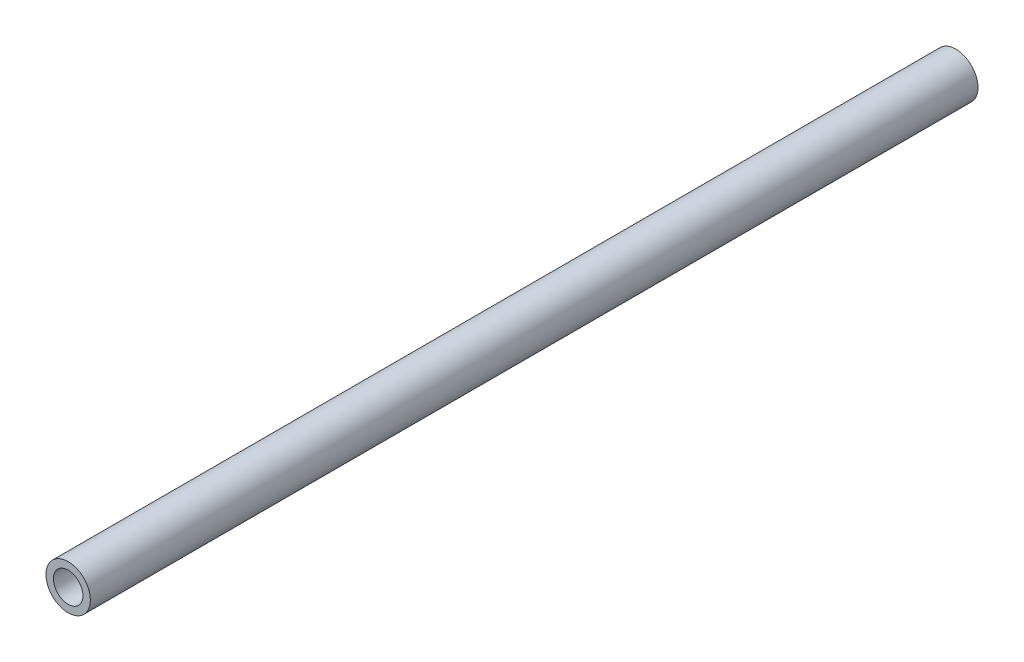
from build123d import *

# Parameters (mm, degrees)
SKETCH1_R           = 9.525
SKETCH1_R_2         = 6.35
BOSS_EXTRUDE1_DEPTH = 381


with BuildPart() as part:
    # Sketch1 → Boss-Extrude1 (new body)
    with BuildSketch(Plane.XY):
        Circle(SKETCH1_R)
        Circle(SKETCH1_R_2, mode=Mode.SUBTRACT)
    extrude(amount=BOSS_EXTRUDE1_DEPTH)


solid = part.part
